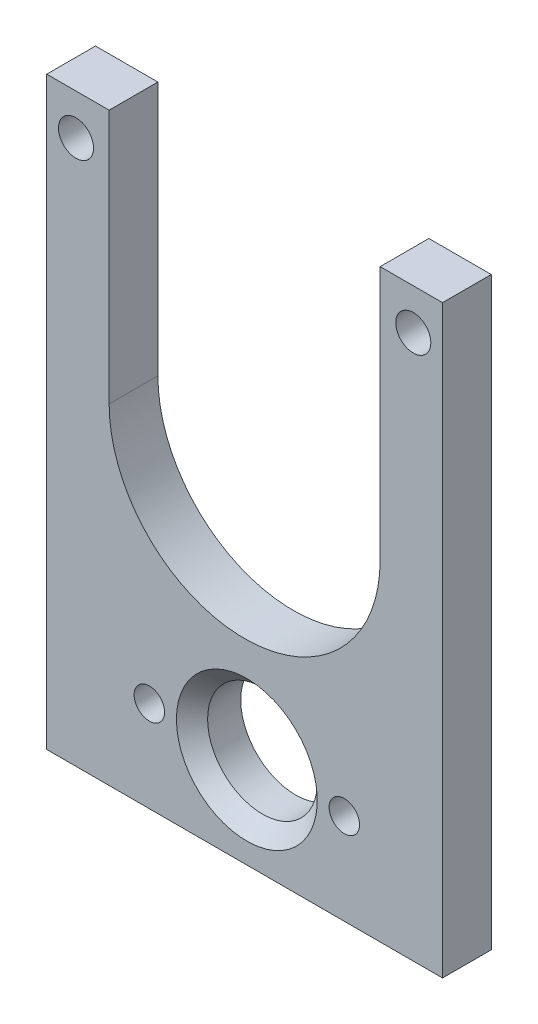
from build123d import *

# Parameters (mm, degrees)
ESQUISSE1_R             = 7.14375
ESQUISSE1_R_2           = 2.286
BOSS_EXTRU_1_DEPTH      = 6.35
ESQUISSE3_R             = 1.984375
ENL_V_MAT_EXTRU_1_DEPTH = 70.699220992
BOSS_EXTRUDE1_DEPTH     = 6.35
CHAMFER1_SIZE           = 2.032


with BuildPart() as part:
    # Esquisse1 → Boss.-Extru.1 (new body)
    with BuildSketch(Plane.XY):
        Polygon((-26.06959879, 64.327559614), (-17.94159879, 64.327559614), (-17.94159879, 13.527559614), (17.36440121, 13.527559614), (17.36440121, 64.327559614), (25.49240121, 64.327559614), (25.49240121, -11.872440386), (-26.06959879, -11.872440386), align=None)
        Circle(ESQUISSE1_R, mode=Mode.SUBTRACT)
        with Locations((21.68240121, 59.024929956)):
            Circle(ESQUISSE1_R_2, mode=Mode.SUBTRACT)
        with Locations((-22.25959879, 59.024929956)):
            Circle(ESQUISSE1_R_2, mode=Mode.SUBTRACT)
    extrude(amount=BOSS_EXTRU_1_DEPTH)

    # Esquisse3 → Enlèv. mat.-Extru.1 (cut, through all)
    with BuildSketch(Plane.XY.offset(6.35)):
        with Locations((12.7, 0)):
            Circle(ESQUISSE3_R)
    enl_v_mat_extru_1 = extrude(amount=-ENL_V_MAT_EXTRU_1_DEPTH, mode=Mode.SUBTRACT)

    # Symétrie1: Enlèv. mat.-Extru.1 across plane
    add(enl_v_mat_extru_1.mirror(Plane(origin=(0, 0, 0), x_dir=(0, 0, 1), z_dir=(1, 0, 0))), mode=Mode.SUBTRACT)

    # Sketch1 → Boss-Extrude1 (add)
    with BuildSketch(Plane.XY.offset(6.35)):
        with BuildLine():
            ThreePointArc((-0.28859879, 13.527559614), (-12.771154798, 18.698003606), (-17.94159879, 31.180559614))
            Line((-17.94159879, 31.180559614), (-17.94159879, 13.527559614))
            Line((-17.94159879, 13.527559614), (-0.28859879, 13.527559614))
        make_face()
        with BuildLine():
            ThreePointArc((17.36440121, 31.180559614), (12.193957219, 18.698003606), (-0.28859879, 13.527559614))
            Line((-0.28859879, 13.527559614), (17.36440121, 13.527559614))
            Line((17.36440121, 13.527559614), (17.36440121, 31.180559614))
        make_face()
    extrude(amount=-BOSS_EXTRUDE1_DEPTH)

    # Chamfer1
    chamfer1_edges = [part.edges().sort_by_distance(p)[0] for p in [
        (-7.14375, 0, 6.35),
    ]]
    chamfer(chamfer1_edges, length=CHAMFER1_SIZE)


solid = part.part
